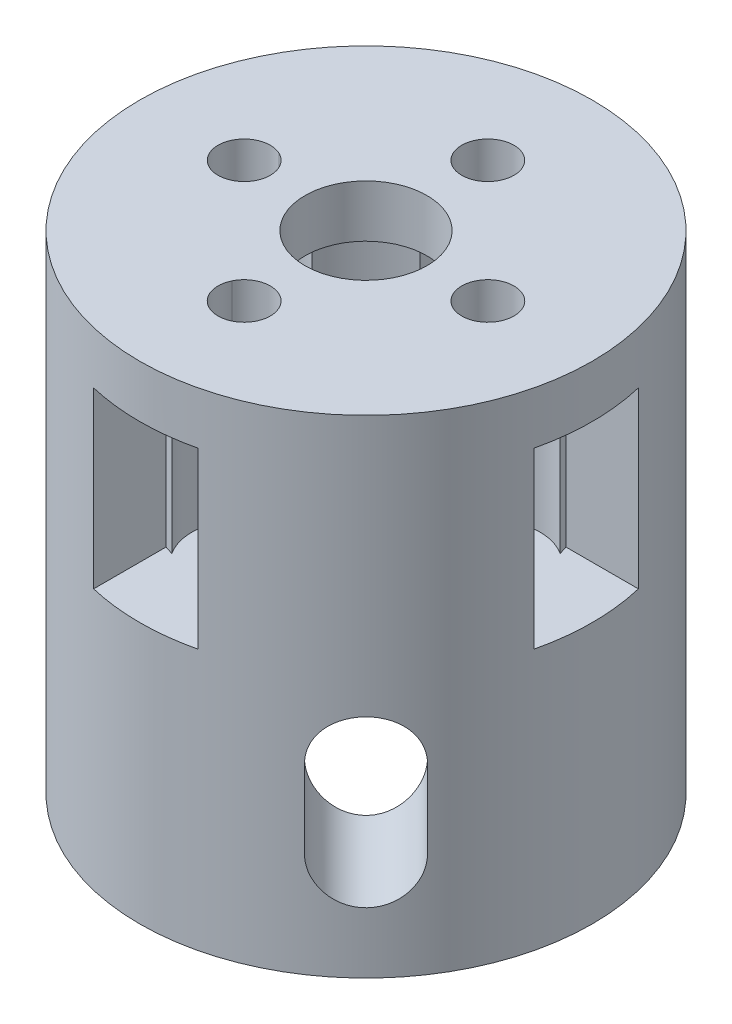
from build123d import *
from build123d.topology import SkipClean

# Parameters (mm, degrees)
BOSS_EXTRUDE2_DEPTH     = 25
BOSS_EXTRUDE2_2_DEPTH   = 25
BOSS_EXTRUDE2_3_DEPTH   = 25
BOSS_EXTRUDE2_4_DEPTH   = 25
BOSS_EXTRUDE3_START     = 3
SKETCH1_4_R             = 13
SKETCH1_4_R_2           = 1.5
SKETCH1_4_R_3           = 3.5
BOSS_EXTRUDE3_DEPTH     = 3
SKETCH1_7_R             = 1.5
CUT_EXTRUDE2_DEPTH      = 3
BOSS_EXTRUDE4_START     = -10
BOSS_EXTRUDE4_DEPTH     = 15
BOSS_EXTRUDE6_DEPTH     = 25
BOSS_EXTRUDE7_DEPTH     = 15
CUT_EXTRUDE1_DEPTH      = 47.121315646
CUT_EXTRUDE1_DEPTH_BACK = 47.121315646


with BuildPart() as part:
    # Sketch1 → Boss-Extrude2 (new body)
    with BuildSketch(Plane(origin=(0, 0, 0), x_dir=(1, 0, 0), z_dir=(0, 1, 0))):
        with BuildLine():
            ThreePointArc((2.781074433, 5.875), (4.596194078, 4.596194078), (5.875, 2.781074433))
            ThreePointArc((5.875, 2.781074433), (7.29221482, 2.985734499), (8.642857143, 2.510183342))
            ThreePointArc((8.642857143, 2.510183342), (6.363961031, 6.363961031), (2.510183342, 8.642857143))
            ThreePointArc((2.510183342, 8.642857143), (2.985734499, 7.29221482), (2.781074433, 5.875))
        make_face()
    extrude(amount=-BOSS_EXTRUDE2_DEPTH)


with BuildPart() as body_2:
    # Sketch1 → Boss-Extrude2 2 (new body)
    with BuildSketch(Plane(origin=(0, 0, 0), x_dir=(1, 0, 0), z_dir=(0, 1, 0))):
        with BuildLine():
            ThreePointArc((8.642857143, -2.510183342), (7.29221482, -2.985734499), (5.875, -2.781074433))
            ThreePointArc((5.875, -2.781074433), (4.596194078, -4.596194078), (2.781074433, -5.875))
            ThreePointArc((2.781074433, -5.875), (2.985734499, -7.29221482), (2.510183342, -8.642857143))
            ThreePointArc((2.510183342, -8.642857143), (6.363961031, -6.363961031), (8.642857143, -2.510183342))
        make_face()
    extrude(amount=-BOSS_EXTRUDE2_2_DEPTH)


    add(part.part)  # Boss-Extrude3 merges part


with BuildPart() as body_3:
    # Sketch1 → Boss-Extrude2 3 (new body)
    with BuildSketch(Plane(origin=(0, 0, 0), x_dir=(1, 0, 0), z_dir=(0, 1, 0))):
        with BuildLine():
            ThreePointArc((-5.875, 2.781074433), (-4.596194078, 4.596194078), (-2.781074433, 5.875))
            ThreePointArc((-2.781074433, 5.875), (-2.985734499, 7.29221482), (-2.510183342, 8.642857143))
            ThreePointArc((-2.510183342, 8.642857143), (-6.363961031, 6.363961031), (-8.642857143, 2.510183342))
            ThreePointArc((-8.642857143, 2.510183342), (-7.29221482, 2.985734499), (-5.875, 2.781074433))
        make_face()
    extrude(amount=-BOSS_EXTRUDE2_3_DEPTH)


with BuildPart() as body_4:
    # Sketch1 → Boss-Extrude2 4 (new body)
    with BuildSketch(Plane(origin=(0, 0, 0), x_dir=(1, 0, 0), z_dir=(0, 1, 0))):
        with BuildLine():
            ThreePointArc((-2.510183342, -8.642857143), (-2.985734499, -7.29221482), (-2.781074433, -5.875))
            ThreePointArc((-2.781074433, -5.875), (-4.596194078, -4.596194078), (-5.875, -2.781074433))
            ThreePointArc((-5.875, -2.781074433), (-7.29221482, -2.985734499), (-8.642857143, -2.510183342))
            ThreePointArc((-8.642857143, -2.510183342), (-6.363961031, -6.363961031), (-2.510183342, -8.642857143))
        make_face()
    extrude(amount=-BOSS_EXTRUDE2_4_DEPTH)


with BuildPart() as body_2_1:
    add(body_2.part)

    add(body_3.part)  # Boss-Extrude3 merges body 3
    # Sketch1<4> → Boss-Extrude3 (add)
    with BuildSketch(Plane(origin=(0, 0, 0), x_dir=(1, 0, 0), z_dir=(0, 1, 0)).offset(BOSS_EXTRUDE3_START)):
        with Locations(Location((0, 0, 0), (0, 0, 270))):
            Circle(SKETCH1_4_R)
        with Locations(Location((7, 0, 0), (0, 0, 270))):
            Circle(SKETCH1_4_R_2, mode=Mode.SUBTRACT)
        with Locations((0, -7)):
            Circle(SKETCH1_4_R_2, mode=Mode.SUBTRACT)
        with Locations((-7, 0)):
            Circle(SKETCH1_4_R_2, mode=Mode.SUBTRACT)
        with Locations(Location((0, 0, 0), (0, 0, 270))):
            Circle(SKETCH1_4_R_3, mode=Mode.SUBTRACT)
        with BuildLine():
            ThreePointArc((1.355261854, 6.357142857), (0, 5.5), (-1.355261854, 6.357142857))
            ThreePointArc((-1.355261854, 6.357142857), (0, 6.5), (1.355261854, 6.357142857))
        make_face(mode=Mode.SUBTRACT)
    extrude(amount=-BOSS_EXTRUDE3_DEPTH)

    # Sketch1<7> → Cut-Extrude2 (cut)
    with BuildSketch(Plane(origin=(0, 0, 0), x_dir=(1, 0, 0), z_dir=(0, 1, 0))):
        with Locations(Location((0, 7, 0), (0, 0, 270))):
            Circle(SKETCH1_7_R)
    extrude(amount=CUT_EXTRUDE2_DEPTH, mode=Mode.SUBTRACT)

    # Sketch1<6> → Boss-Extrude4 (add)
    with BuildSketch(Plane(origin=(0, 0, 0), x_dir=(1, 0, 0), z_dir=(0, 1, 0)).offset(BOSS_EXTRUDE4_START)):
        with BuildLine():
            ThreePointArc((5.875, -2.781074433), (7.29221482, -2.985734499), (8.642857143, -2.510183342))
            ThreePointArc((8.642857143, -2.510183342), (9, 0), (8.642857143, 2.510183342))
            ThreePointArc((8.642857143, 2.510183342), (7.29221482, 2.985734499), (5.875, 2.781074433))
            ThreePointArc((5.875, 2.781074433), (6.5, 0), (5.875, -2.781074433))
        make_face()
        with BuildLine():
            ThreePointArc((2.781074433, 5.875), (2.985734499, 7.29221482), (2.510183342, 8.642857143))
            ThreePointArc((2.510183342, 8.642857143), (0, 9), (-2.510183342, 8.642857143))
            ThreePointArc((-2.510183342, 8.642857143), (-2.985734499, 7.29221482), (-2.781074433, 5.875))
            ThreePointArc((-2.781074433, 5.875), (0, 6.5), (2.781074433, 5.875))
        make_face()
        with BuildLine():
            ThreePointArc((2.510183342, -8.642857143), (2.985734499, -7.29221482), (2.781074433, -5.875))
            ThreePointArc((2.781074433, -5.875), (0, -6.5), (-2.781074433, -5.875))
            ThreePointArc((-2.781074433, -5.875), (-2.985734499, -7.29221482), (-2.510183342, -8.642857143))
            ThreePointArc((-2.510183342, -8.642857143), (0, -9), (2.510183342, -8.642857143))
        make_face()
        with BuildLine():
            ThreePointArc((-5.875, 2.781074433), (-7.29221482, 2.985734499), (-8.642857143, 2.510183342))
            ThreePointArc((-8.642857143, 2.510183342), (-9, 0), (-8.642857143, -2.510183342))
            ThreePointArc((-8.642857143, -2.510183342), (-7.29221482, -2.985734499), (-5.875, -2.781074433))
            ThreePointArc((-5.875, -2.781074433), (-6.5, 0), (-5.875, 2.781074433))
        make_face()
    extrude(amount=-BOSS_EXTRUDE4_DEPTH)


    with SkipClean():  # the faces are left unmerged after this step: merging them gives an invalid solid
        add(body_4.part)  # Boss-Extrude6 merges body 4
        # Sketch3 → Boss-Extrude6 (add)
        with BuildSketch(Plane.XZ):
            with BuildLine():
                Line((-8.485281374, -3), (-12.649110641, -3))
                ThreePointArc((-12.649110641, -3), (-9.192388155, -9.192388155), (-3, -12.649110641))
                Line((-3, -12.649110641), (-3, -8.485281374))
                ThreePointArc((-3, -8.485281374), (-6.363961031, -6.363961031), (-8.485281374, -3))
            make_face()
            with BuildLine():
                ThreePointArc((3, -12.649110641), (9.192388155, -9.192388155), (12.649110641, -3))
                Line((12.649110641, -3), (8.485281374, -3))
                ThreePointArc((8.485281374, -3), (6.363961031, -6.363961031), (3, -8.485281374))
                Line((3, -8.485281374), (3, -12.649110641))
            make_face()
            with BuildLine():
                ThreePointArc((12.649110641, 3), (9.192388155, 9.192388155), (3, 12.649110641))
                Line((3, 12.649110641), (3, 8.485281374))
                ThreePointArc((3, 8.485281374), (6.363961031, 6.363961031), (8.485281374, 3))
                Line((8.485281374, 3), (12.649110641, 3))
            make_face()
            with BuildLine():
                Line((-3, 8.485281374), (-3, 12.649110641))
                ThreePointArc((-3, 12.649110641), (-9.192388155, 9.192388155), (-12.649110641, 3))
                Line((-12.649110641, 3), (-8.485281374, 3))
                ThreePointArc((-8.485281374, 3), (-6.363961031, 6.363961031), (-3, 8.485281374))
            make_face()
        extrude(amount=BOSS_EXTRUDE6_DEPTH)

    # Sketch4 → Boss-Extrude7 (add)
    with SkipClean():  # the faces are left unmerged after this step: merging them gives an invalid solid
        with BuildSketch(Plane.XZ.offset(25)):
            with BuildLine():
                Line((3, -12.649110641), (3, -8.485281374))
                ThreePointArc((3, -8.485281374), (0, -9), (-3, -8.485281374))
                Line((-3, -8.485281374), (-3, -12.649110641))
                ThreePointArc((-3, -12.649110641), (0, -13), (3, -12.649110641))
            make_face()
            with BuildLine():
                ThreePointArc((-8.485281374, -3), (-9, 0), (-8.485281374, 3))
                Line((-8.485281374, 3), (-12.649110641, 3))
                ThreePointArc((-12.649110641, 3), (-13, 0), (-12.649110641, -3))
                Line((-12.649110641, -3), (-8.485281374, -3))
            make_face()
            with BuildLine():
                ThreePointArc((8.485281374, 3), (8.870387037, 1.521917809), (9, 0))
                ThreePointArc((9, 0), (8.870387037, -1.521917809), (8.485281374, -3))
                Line((8.485281374, -3), (12.649110641, -3))
                ThreePointArc((12.649110641, -3), (12.911979676, -1.510225425), (13, 0))
                ThreePointArc((13, 0), (12.911979676, 1.510225425), (12.649110641, 3))
                Line((12.649110641, 3), (8.485281374, 3))
            make_face()
            with BuildLine():
                ThreePointArc((-3, 8.485281374), (0, 9), (3, 8.485281374))
                Line((3, 8.485281374), (3, 12.649110641))
                ThreePointArc((3, 12.649110641), (0, 13), (-3, 12.649110641))
                Line((-3, 12.649110641), (-3, 8.485281374))
            make_face()
        extrude(amount=-BOSS_EXTRUDE7_DEPTH)

    # Sketch2 → Cut-Extrude1 (cut, two sides: drawn at the far end of the back side and taken through both)
    with SkipClean():  # the faces are left unmerged after this step: merging them gives an invalid solid
        with BuildSketch(Plane(origin=(20.02081528, 0, -7.292893219), x_dir=(-0.7071067811865485, 0, 0.7071067811865466), z_dir=(-0.7071067811865466, 0, -0.7071067811865485)).offset(-CUT_EXTRUDE1_DEPTH_BACK)):
            with BuildLine():
                Line((16.813708499, -14.5), (16.813708499, -19))
                ThreePointArc((16.813708499, -19), (19.313708499, -21.5), (21.813708499, -19))
                Line((21.813708499, -19), (21.813708499, -14.5))
                ThreePointArc((21.813708499, -14.5), (19.313708499, -12), (16.813708499, -14.5))
            make_face()
        extrude(amount=CUT_EXTRUDE1_DEPTH + CUT_EXTRUDE1_DEPTH_BACK, mode=Mode.SUBTRACT)


solid = body_2_1.part
